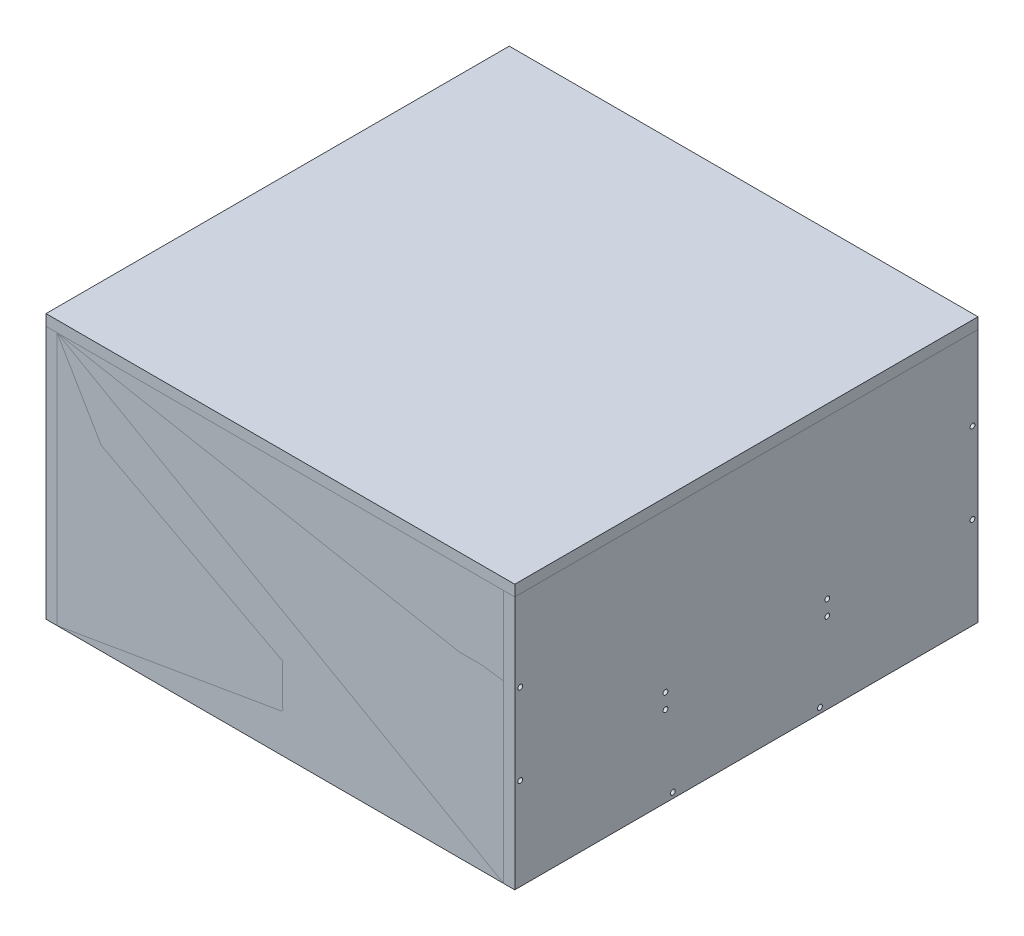
from build123d import *

# Parameters (mm, degrees)
SKETCH1_W                       = 257.175
SKETCH1_H                       = 254
BOSS_EXTRUDE1_DEPTH             = 6.35
SKETCH2_W                       = 257.175
SKETCH2_H                       = 146.05
BOSS_EXTRUDE2_DEPTH             = 6.35
SKETCH4_W                       = 266.7
SKETCH4_H                       = 146.05
BOSS_EXTRUDE3_DEPTH             = 6.35
SKETCH6_W                       = 12.7
SKETCH6_H                       = 254
BOSS_EXTRUDE4_DEPTH             = 57.15
SKETCH8_W                       = 12.7
SKETCH8_H                       = 12.7
CUT_EXTRUDE1_DEPTH              = 25.4
SKETCH11_W                      = 257.175
SKETCH11_H                      = 12.7
BOSS_EXTRUDE6_DEPTH             = 25.4
SKETCH23_W                      = 1.397
SKETCH23_H                      = 269.875
F_4_40_TAPPED_HOLE5_AT_2_COUNT  = 2
F_4_40_TAPPED_HOLE5_AT_2_PITCH  = 46.566666667
F_4_40_TAPPED_HOLE5_AT_3_COUNT  = 2
F_4_40_TAPPED_HOLE5_AT_3_PITCH  = 130.345564143
F_4_40_TAPPED_HOLE5_AT_4_COUNT  = 2
F_4_40_TAPPED_HOLE5_AT_4_PITCH  = 197.578696604
F_4_40_TAPPED_HOLE5_AT_5_COUNT  = 2
F_4_40_TAPPED_HOLE5_AT_5_PITCH  = 98.992397374
F_4_40_TAPPED_HOLE5_AT_6_COUNT  = 2
F_4_40_TAPPED_HOLE5_AT_6_PITCH  = 94.650072396
F_4_40_TAPPED_HOLE5_AT_7_COUNT  = 2
F_4_40_TAPPED_HOLE5_AT_7_PITCH  = 182.224859824
F_4_40_TAPPED_HOLE5_AT_8_COUNT  = 2
F_4_40_TAPPED_HOLE5_AT_8_PITCH  = 184.517636206
F_4_40_TAPPED_HOLE5_AT_9_COUNT  = 2
F_4_40_TAPPED_HOLE5_AT_9_PITCH  = 264.481713819
F_4_40_TAPPED_HOLE5_AT_10_COUNT = 2
F_4_40_TAPPED_HOLE5_AT_10_PITCH = 260.35
SKETCH25_W                      = 1.397
SKETCH25_H                      = 260.35
F_4_40_TAPPED_HOLE4_AT_2_COUNT  = 2
F_4_40_TAPPED_HOLE4_AT_2_PITCH  = 23.283333333
SKETCH26_W                      = 269.875
SKETCH26_H                      = 266.7
BOSS_EXTRUDE7_DEPTH             = 6.35
CUT_EXTRUDE2_DEPTH              = 6.35
CUT_EXTRUDE3_DEPTH              = 6.35
CUT_EXTRUDE4_DEPTH              = 12.7


with BuildPart() as part:
    # Sketch1 → Boss-Extrude1 (new body)
    with BuildSketch(Plane(origin=(0, 0, 0), x_dir=(1, 0, 0), z_dir=(0, 1, 0))):
        with Locations((128.5875, 127)):
            Rectangle(SKETCH1_W, SKETCH1_H)
    extrude(amount=-BOSS_EXTRUDE1_DEPTH)


with BuildPart() as body_2:
    # Sketch2 → Boss-Extrude2 (new body)
    with BuildSketch(Plane.XY):
        with Locations((128.5875, 66.675)):
            Rectangle(SKETCH2_W, SKETCH2_H)
    extrude(amount=BOSS_EXTRUDE2_DEPTH)


with BuildPart() as body_3:
    # Mirror1: mirrored copy
    add(body_2.part.mirror(Plane(origin=(0, 0, -127), x_dir=(1, 0, 0), z_dir=(0, 0, -1))))


with BuildPart() as body_4:
    # Sketch4 → Boss-Extrude3 (new body)
    with BuildSketch(Plane.ZY):
        with Locations((-127, 66.675)):
            Rectangle(SKETCH4_W, SKETCH4_H)
    extrude(amount=BOSS_EXTRUDE3_DEPTH)


with BuildPart() as body_5:
    # Mirror2: mirrored copy
    add(body_4.part.mirror(Plane(origin=(128.5875, -6.35, 0), x_dir=(0, 0, 1), z_dir=(-1, 0, 0))))


with BuildPart() as body_6:
    # Sketch6 → Boss-Extrude4 (new body)
    with BuildSketch(Plane.XZ):
        with Locations((128.5875, -127)):
            Rectangle(SKETCH6_W, SKETCH6_H)
    extrude(amount=-BOSS_EXTRUDE4_DEPTH)

    # Sketch8 → Cut-Extrude1 (cut)
    with BuildSketch(Plane(origin=(0, 57.15, 0), x_dir=(-1, 0, 0), z_dir=(0, 1, 0))):
        with Locations((-128.5875, -80.433333333)):
            Rectangle(SKETCH8_W, SKETCH8_H)
        with Locations((-128.5875, -173.566666667)):
            Rectangle(SKETCH8_W, SKETCH8_H)
    extrude(amount=-CUT_EXTRUDE1_DEPTH, mode=Mode.SUBTRACT)


with BuildPart() as body_7:
    # Sketch11 → Boss-Extrude6 (new body)
    with BuildSketch(Plane(origin=(0, 31.75, 0), x_dir=(-1, 0, 0), z_dir=(0, 1, 0))):
        with Locations((-128.5875, -173.566666667)):
            Rectangle(SKETCH11_W, SKETCH11_H)
    extrude(amount=BOSS_EXTRUDE6_DEPTH)


with BuildPart() as body_8:
    # Mirror3: mirrored copy
    add(body_7.part.mirror(Plane(origin=(0, 0, -127), x_dir=(1, 0, 0), z_dir=(0, 0, -1))))


with BuildPart() as f_4_40_tapped_hole5_tool:
    # Sketch23 → #4-40 Tapped Hole5 (revolve)
    with BuildSketch(Plane(origin=(-6.35, 93.133333333, -257.175), x_dir=(0, 0, 1), z_dir=(0, 1, 0))):
        with Locations((0.6985, 134.9375)):
            Rectangle(SKETCH23_W, SKETCH23_H)
    f_4_40_tapped_hole5 = revolve(axis=Axis((-12.7, 93.133333333, -257.175), (1, 0, 0)))


with BuildPart() as body_3_1:
    add(body_3.part)

    # #4-40 Tapped Hole5: cut by f_4_40_tapped_hole5_tool
    add(f_4_40_tapped_hole5_tool.part, mode=Mode.SUBTRACT)


with BuildPart() as body_4_1:
    add(body_4.part)

    # #4-40 Tapped Hole5: cut by f_4_40_tapped_hole5_tool
    add(f_4_40_tapped_hole5_tool.part, mode=Mode.SUBTRACT)


with BuildPart() as body_5_1:
    add(body_5.part)

    # #4-40 Tapped Hole5: cut by f_4_40_tapped_hole5_tool
    add(f_4_40_tapped_hole5_tool.part, mode=Mode.SUBTRACT)


with BuildPart() as f_4_40_tapped_hole5_at_2_tool:
    # #4-40 Tapped Hole5 at 2: #4-40 Tapped Hole5 ×2
    with Locations(*[(0, -i * F_4_40_TAPPED_HOLE5_AT_2_PITCH, 0) for i in range(1, F_4_40_TAPPED_HOLE5_AT_2_COUNT)]):
        add(f_4_40_tapped_hole5)


with BuildPart() as body_3_2:
    add(body_3_1.part)

    # #4-40 Tapped Hole5 at 2: cut by f_4_40_tapped_hole5_at_2_tool
    add(f_4_40_tapped_hole5_at_2_tool.part, mode=Mode.SUBTRACT)


with BuildPart() as body_4_2:
    add(body_4_1.part)

    # #4-40 Tapped Hole5 at 2: cut by f_4_40_tapped_hole5_at_2_tool
    add(f_4_40_tapped_hole5_at_2_tool.part, mode=Mode.SUBTRACT)


with BuildPart() as body_5_2:
    add(body_5_1.part)

    # #4-40 Tapped Hole5 at 2: cut by f_4_40_tapped_hole5_at_2_tool
    add(f_4_40_tapped_hole5_at_2_tool.part, mode=Mode.SUBTRACT)


with BuildPart() as f_4_40_tapped_hole5_at_3_tool:
    # #4-40 Tapped Hole5 at 3: #4-40 Tapped Hole5 ×2
    with Locations(*[Vector(0, -0.7388692815651203, 0.6738487847873906) * (i * F_4_40_TAPPED_HOLE5_AT_3_PITCH) for i in range(1, F_4_40_TAPPED_HOLE5_AT_3_COUNT)]):
        add(f_4_40_tapped_hole5)


with BuildPart() as part_1:
    add(part.part)

    # #4-40 Tapped Hole5 at 3: cut by f_4_40_tapped_hole5_at_3_tool
    add(f_4_40_tapped_hole5_at_3_tool.part, mode=Mode.SUBTRACT)


with BuildPart() as body_4_3:
    add(body_4_2.part)

    # #4-40 Tapped Hole5 at 3: cut by f_4_40_tapped_hole5_at_3_tool
    add(f_4_40_tapped_hole5_at_3_tool.part, mode=Mode.SUBTRACT)


with BuildPart() as body_5_3:
    add(body_5_2.part)

    # #4-40 Tapped Hole5 at 3: cut by f_4_40_tapped_hole5_at_3_tool
    add(f_4_40_tapped_hole5_at_3_tool.part, mode=Mode.SUBTRACT)


with BuildPart() as f_4_40_tapped_hole5_at_4_tool:
    # #4-40 Tapped Hole5 at 4: #4-40 Tapped Hole5 ×2
    with Locations(*[Vector(0, -0.48744290244217797, 0.8731548641900504) * (i * F_4_40_TAPPED_HOLE5_AT_4_PITCH) for i in range(1, F_4_40_TAPPED_HOLE5_AT_4_COUNT)]):
        add(f_4_40_tapped_hole5)


with BuildPart() as part_2:
    add(part_1.part)

    # #4-40 Tapped Hole5 at 4: cut by f_4_40_tapped_hole5_at_4_tool
    add(f_4_40_tapped_hole5_at_4_tool.part, mode=Mode.SUBTRACT)

    # Sketch39 → Cut-Extrude3 (cut)
    with BuildSketch(Plane.XZ.offset(6.35)):
        Polygon((0, -83.2612), (0, -86.0552), (12.7, -86.0552), (12.7, -87.8332), (25.4, -87.8332), (25.4, -81.4832), (12.7, -81.4832), (12.7, -83.2612), align=None)
        Polygon((0, -167.9448), (0, -170.7388), (12.7, -170.7388), (12.7, -172.5168), (25.4, -172.5168), (25.4, -166.1668), (12.7, -166.1668), (12.7, -167.9448), align=None)
        Polygon((244.475, -167.9448), (244.475, -166.1668), (231.775, -166.1668), (231.775, -172.5168), (244.475, -172.5168), (244.475, -170.7388), (257.175, -170.7388), (257.175, -167.9448), align=None)
        Polygon((244.475, -83.2612), (244.475, -81.4832), (231.775, -81.4832), (231.775, -87.8332), (244.475, -87.8332), (244.475, -86.0552), (257.175, -86.0552), (257.175, -83.2612), align=None)
    extrude(amount=-CUT_EXTRUDE3_DEPTH, mode=Mode.SUBTRACT)


with BuildPart() as body_4_4:
    add(body_4_3.part)

    # #4-40 Tapped Hole5 at 4: cut by f_4_40_tapped_hole5_at_4_tool
    add(f_4_40_tapped_hole5_at_4_tool.part, mode=Mode.SUBTRACT)


with BuildPart() as body_5_4:
    add(body_5_3.part)

    # #4-40 Tapped Hole5 at 4: cut by f_4_40_tapped_hole5_at_4_tool
    add(f_4_40_tapped_hole5_at_4_tool.part, mode=Mode.SUBTRACT)


with BuildPart() as f_4_40_tapped_hole5_at_5_tool:
    # #4-40 Tapped Hole5 at 5: #4-40 Tapped Hole5 ×2
    with Locations(*[Vector(0, -0.5354081196052933, 0.8445934794093096) * (i * F_4_40_TAPPED_HOLE5_AT_5_PITCH) for i in range(1, F_4_40_TAPPED_HOLE5_AT_5_COUNT)]):
        add(f_4_40_tapped_hole5)


with BuildPart() as body_4_5:
    add(body_4_4.part)

    # #4-40 Tapped Hole5 at 5: cut by f_4_40_tapped_hole5_at_5_tool
    add(f_4_40_tapped_hole5_at_5_tool.part, mode=Mode.SUBTRACT)


with BuildPart() as body_5_5:
    add(body_5_4.part)

    # #4-40 Tapped Hole5 at 5: cut by f_4_40_tapped_hole5_at_5_tool
    add(f_4_40_tapped_hole5_at_5_tool.part, mode=Mode.SUBTRACT)


with BuildPart() as body_7_1:
    add(body_7.part)

    # #4-40 Tapped Hole5 at 5: cut by f_4_40_tapped_hole5_at_5_tool
    add(f_4_40_tapped_hole5_at_5_tool.part, mode=Mode.SUBTRACT)


with BuildPart() as f_4_40_tapped_hole5_at_6_tool:
    # #4-40 Tapped Hole5 at 6: #4-40 Tapped Hole5 ×2
    with Locations(*[Vector(0, -0.4687300517610498, 0.8833414620496899) * (i * F_4_40_TAPPED_HOLE5_AT_6_PITCH) for i in range(1, F_4_40_TAPPED_HOLE5_AT_6_COUNT)]):
        add(f_4_40_tapped_hole5)


with BuildPart() as body_4_6:
    add(body_4_5.part)

    # #4-40 Tapped Hole5 at 6: cut by f_4_40_tapped_hole5_at_6_tool
    add(f_4_40_tapped_hole5_at_6_tool.part, mode=Mode.SUBTRACT)


with BuildPart() as body_5_6:
    add(body_5_5.part)

    # #4-40 Tapped Hole5 at 6: cut by f_4_40_tapped_hole5_at_6_tool
    add(f_4_40_tapped_hole5_at_6_tool.part, mode=Mode.SUBTRACT)


with BuildPart() as body_7_2:
    add(body_7_1.part)

    # #4-40 Tapped Hole5 at 6: cut by f_4_40_tapped_hole5_at_6_tool
    add(f_4_40_tapped_hole5_at_6_tool.part, mode=Mode.SUBTRACT)


with BuildPart() as f_4_40_tapped_hole5_at_7_tool:
    # #4-40 Tapped Hole5 at 7: #4-40 Tapped Hole5 ×2
    with Locations(*[Vector(0, -0.24346476861705243, 0.9699097413894991) * (i * F_4_40_TAPPED_HOLE5_AT_7_PITCH) for i in range(1, F_4_40_TAPPED_HOLE5_AT_7_COUNT)]):
        add(f_4_40_tapped_hole5)


with BuildPart() as body_4_7:
    add(body_4_6.part)

    # #4-40 Tapped Hole5 at 7: cut by f_4_40_tapped_hole5_at_7_tool
    add(f_4_40_tapped_hole5_at_7_tool.part, mode=Mode.SUBTRACT)


with BuildPart() as body_5_7:
    add(body_5_6.part)

    # #4-40 Tapped Hole5 at 7: cut by f_4_40_tapped_hole5_at_7_tool
    add(f_4_40_tapped_hole5_at_7_tool.part, mode=Mode.SUBTRACT)


with BuildPart() as body_8_1:
    add(body_8.part)

    # #4-40 Tapped Hole5 at 7: cut by f_4_40_tapped_hole5_at_7_tool
    add(f_4_40_tapped_hole5_at_7_tool.part, mode=Mode.SUBTRACT)


with BuildPart() as f_4_40_tapped_hole5_at_8_tool:
    # #4-40 Tapped Hole5 at 8: #4-40 Tapped Hole5 ×2
    with Locations(*[Vector(0, -0.2872426420747504, 0.9578578519665206) * (i * F_4_40_TAPPED_HOLE5_AT_8_PITCH) for i in range(1, F_4_40_TAPPED_HOLE5_AT_8_COUNT)]):
        add(f_4_40_tapped_hole5)


with BuildPart() as body_4_8:
    add(body_4_7.part)

    # #4-40 Tapped Hole5 at 8: cut by f_4_40_tapped_hole5_at_8_tool
    add(f_4_40_tapped_hole5_at_8_tool.part, mode=Mode.SUBTRACT)


with BuildPart() as body_5_8:
    add(body_5_7.part)

    # #4-40 Tapped Hole5 at 8: cut by f_4_40_tapped_hole5_at_8_tool
    add(f_4_40_tapped_hole5_at_8_tool.part, mode=Mode.SUBTRACT)


with BuildPart() as body_8_2:
    add(body_8_1.part)

    # #4-40 Tapped Hole5 at 8: cut by f_4_40_tapped_hole5_at_8_tool
    add(f_4_40_tapped_hole5_at_8_tool.part, mode=Mode.SUBTRACT)


with BuildPart() as f_4_40_tapped_hole5_at_9_tool:
    # #4-40 Tapped Hole5 at 9: #4-40 Tapped Hole5 ×2
    with Locations(*[Vector(0, -0.17606762295331477, 0.9843780737844425) * (i * F_4_40_TAPPED_HOLE5_AT_9_PITCH) for i in range(1, F_4_40_TAPPED_HOLE5_AT_9_COUNT)]):
        add(f_4_40_tapped_hole5)


with BuildPart() as body_2_1:
    add(body_2.part)

    # #4-40 Tapped Hole5 at 9: cut by f_4_40_tapped_hole5_at_9_tool
    add(f_4_40_tapped_hole5_at_9_tool.part, mode=Mode.SUBTRACT)


with BuildPart() as body_4_9:
    add(body_4_8.part)

    # #4-40 Tapped Hole5 at 9: cut by f_4_40_tapped_hole5_at_9_tool
    add(f_4_40_tapped_hole5_at_9_tool.part, mode=Mode.SUBTRACT)


with BuildPart() as body_5_9:
    add(body_5_8.part)

    # #4-40 Tapped Hole5 at 9: cut by f_4_40_tapped_hole5_at_9_tool
    add(f_4_40_tapped_hole5_at_9_tool.part, mode=Mode.SUBTRACT)


with BuildPart() as f_4_40_tapped_hole5_at_10_tool:
    # #4-40 Tapped Hole5 at 10: #4-40 Tapped Hole5 ×2
    with Locations(*[(0, 0, i * F_4_40_TAPPED_HOLE5_AT_10_PITCH) for i in range(1, F_4_40_TAPPED_HOLE5_AT_10_COUNT)]):
        add(f_4_40_tapped_hole5)


with BuildPart() as body_2_2:
    add(body_2_1.part)

    # #4-40 Tapped Hole5 at 10: cut by f_4_40_tapped_hole5_at_10_tool
    add(f_4_40_tapped_hole5_at_10_tool.part, mode=Mode.SUBTRACT)


with BuildPart() as body_4_10:
    add(body_4_9.part)

    # #4-40 Tapped Hole5 at 10: cut by f_4_40_tapped_hole5_at_10_tool
    add(f_4_40_tapped_hole5_at_10_tool.part, mode=Mode.SUBTRACT)


with BuildPart() as body_5_10:
    add(body_5_9.part)

    # #4-40 Tapped Hole5 at 10: cut by f_4_40_tapped_hole5_at_10_tool
    add(f_4_40_tapped_hole5_at_10_tool.part, mode=Mode.SUBTRACT)


with BuildPart() as f_4_40_tapped_hole4_tool:
    # Sketch25 → #4-40 Tapped Hole4 (revolve)
    with BuildSketch(Plane(origin=(128.5875, 40.216666667, 0), x_dir=(0, -1, 0), z_dir=(1, 0, 0))):
        with Locations((0.6985, 130.175)):
            Rectangle(SKETCH25_W, SKETCH25_H)
    f_4_40_tapped_hole4 = revolve(axis=Axis((128.5875, 40.216666667, 6.35), (0, 0, -1)))


with BuildPart() as body_3_3:
    add(body_3_2.part)

    # #4-40 Tapped Hole4: cut by f_4_40_tapped_hole4_tool
    add(f_4_40_tapped_hole4_tool.part, mode=Mode.SUBTRACT)


with BuildPart() as body_6_1:
    add(body_6.part)

    # #4-40 Tapped Hole4: cut by f_4_40_tapped_hole4_tool
    add(f_4_40_tapped_hole4_tool.part, mode=Mode.SUBTRACT)


with BuildPart() as body_7_3:
    add(body_7_2.part)

    # #4-40 Tapped Hole4: cut by f_4_40_tapped_hole4_tool
    add(f_4_40_tapped_hole4_tool.part, mode=Mode.SUBTRACT)


with BuildPart() as body_8_3:
    add(body_8_2.part)

    # #4-40 Tapped Hole4: cut by f_4_40_tapped_hole4_tool
    add(f_4_40_tapped_hole4_tool.part, mode=Mode.SUBTRACT)


with BuildPart() as f_4_40_tapped_hole4_at_2_tool:
    # #4-40 Tapped Hole4 at 2: #4-40 Tapped Hole4 ×2
    with Locations(*[(0, -i * F_4_40_TAPPED_HOLE4_AT_2_PITCH, 0) for i in range(1, F_4_40_TAPPED_HOLE4_AT_2_COUNT)]):
        add(f_4_40_tapped_hole4)


with BuildPart() as body_3_4:
    add(body_3_3.part)

    # #4-40 Tapped Hole4 at 2: cut by f_4_40_tapped_hole4_at_2_tool
    add(f_4_40_tapped_hole4_at_2_tool.part, mode=Mode.SUBTRACT)

    # Sketch35 → Cut-Extrude2 (cut)
    with BuildSketch(Plane(origin=(0, 0, -260.35), x_dir=(-1, 0, 0), z_dir=(0, 0, -1))):
        Polygon((-257.175, 94.530333333), (-257.175, 91.736333333), (-244.475, 91.736333333), (-244.475, 89.958333333), (-231.775, 89.958333333), (-231.775, 96.308333333), (-244.475, 96.308333333), (-244.475, 94.530333333), align=None)
        Polygon((-257.175, 47.963666667), (-257.175, 45.169666667), (-244.475, 45.169666667), (-244.475, 43.391666667), (-231.775, 43.391666667), (-231.775, 49.741666667), (-244.475, 49.741666667), (-244.475, 47.963666667), align=None)
        Polygon((-12.7, 47.963666667), (-12.7, 49.741666667), (-25.4, 49.741666667), (-25.4, 43.391666667), (-12.7, 43.391666667), (-12.7, 45.169666667), (0, 45.169666667), (0, 47.963666667), align=None)
        Polygon((-12.7, 94.530333333), (-12.7, 96.308333333), (-25.4, 96.308333333), (-25.4, 89.958333333), (-12.7, 89.958333333), (-12.7, 91.736333333), (0, 91.736333333), (0, 94.530333333), align=None)
    extrude(amount=-CUT_EXTRUDE2_DEPTH, mode=Mode.SUBTRACT)


with BuildPart() as body_6_2:
    add(body_6_1.part)

    # #4-40 Tapped Hole4 at 2: cut by f_4_40_tapped_hole4_at_2_tool
    add(f_4_40_tapped_hole4_at_2_tool.part, mode=Mode.SUBTRACT)

    # Sketch43 → Cut-Extrude4 (cut)
    with BuildSketch(Plane.ZY.offset(-122.2375)):
        Polygon((-254, 18.330333333), (-254, 15.536333333), (-241.3, 15.536333333), (-241.3, 13.758333333), (-228.6, 13.758333333), (-228.6, 20.108333333), (-241.3, 20.108333333), (-241.3, 18.330333333), align=None)
        Polygon((-241.3, 38.819666667), (-241.3, 37.041666667), (-228.6, 37.041666667), (-228.6, 43.391666667), (-241.3, 43.391666667), (-241.3, 41.613666667), (-254, 41.613666667), (-254, 38.819666667), align=None)
        Polygon((0, 38.819666667), (0, 41.613666667), (-12.7, 41.613666667), (-12.7, 43.391666667), (-25.4, 43.391666667), (-25.4, 37.041666667), (-12.7, 37.041666667), (-12.7, 38.819666667), align=None)
        Polygon((-12.7, 18.330333333), (-12.7, 20.108333333), (-25.4, 20.108333333), (-25.4, 13.758333333), (-12.7, 13.758333333), (-12.7, 15.536333333), (0, 15.536333333), (0, 18.330333333), align=None)
    extrude(amount=-CUT_EXTRUDE4_DEPTH, mode=Mode.SUBTRACT)


with BuildPart() as body_9:
    # Sketch26 → Boss-Extrude7 (new body)
    with BuildSketch(Plane(origin=(0, 139.7, 0), x_dir=(-1, 0, 0), z_dir=(0, 1, 0))):
        with Locations((-128.5875, -127)):
            Rectangle(SKETCH26_W, SKETCH26_H)
    extrude(amount=BOSS_EXTRUDE7_DEPTH)


with BuildPart() as body_10:
    # Mirror7: mirrored copy
    add(body_3_4.part.mirror(Plane(origin=(-6.35, -6.35, -127), x_dir=(1, 0, 0), z_dir=(0, 0, -1))))


solid = Compound([part_2.part, body_2_2.part, body_4_10.part, body_5_10.part, body_7_3.part, body_8_3.part, body_3_4.part, body_6_2.part, body_9.part, body_10.part])
